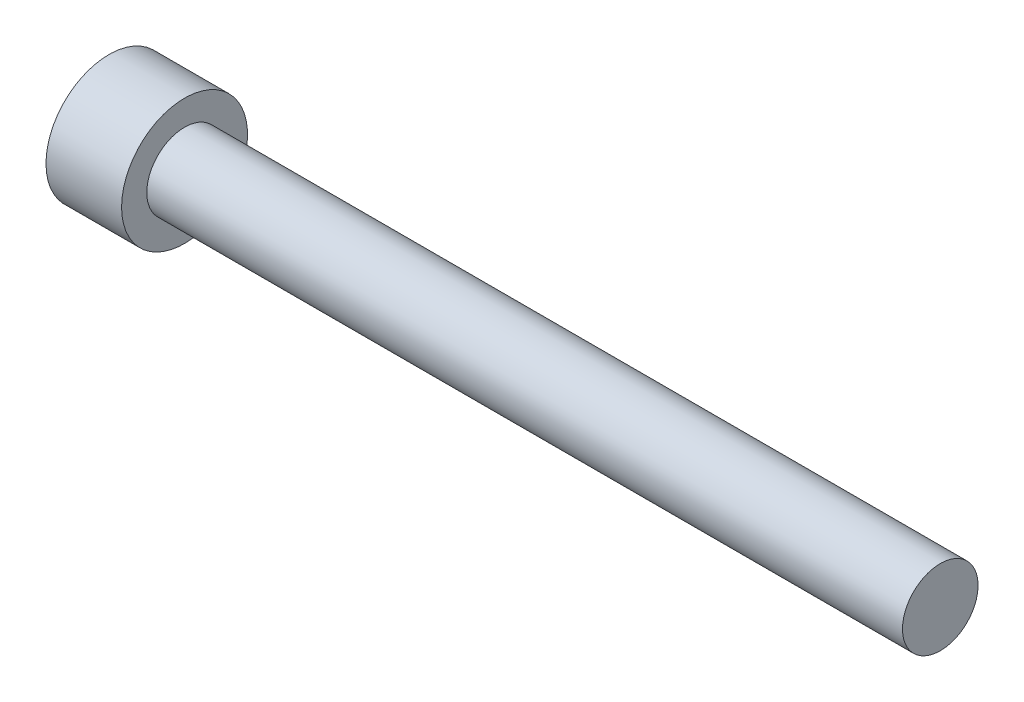
from build123d import *

# Parameters (mm, degrees)
SOCKET_DEPTH = 3


with BuildPart() as part:
    # Screw Sketch → Screw (revolve)
    with BuildSketch(Plane.XY):
        Polygon((-6, 0), (-6, 5), (0, 5), (0, 3), (60, 3), (60, 0), align=None)
    revolve(axis=Axis((-1000, 0, 0), (1, 0, 0)))

    # Socket Sketch → Socket (cut)
    with BuildSketch(Plane(origin=(-6, 0, 0), x_dir=(0, 0, -1), z_dir=(1, 0, 0))):
        Polygon((2.886751346, 0), (1.443375673, 2.5), (-1.443375673, 2.5), (-2.886751346, 0), (-1.443375673, -2.5), (1.443375673, -2.5), align=None)
    extrude(amount=SOCKET_DEPTH, mode=Mode.SUBTRACT)


solid = part.part
